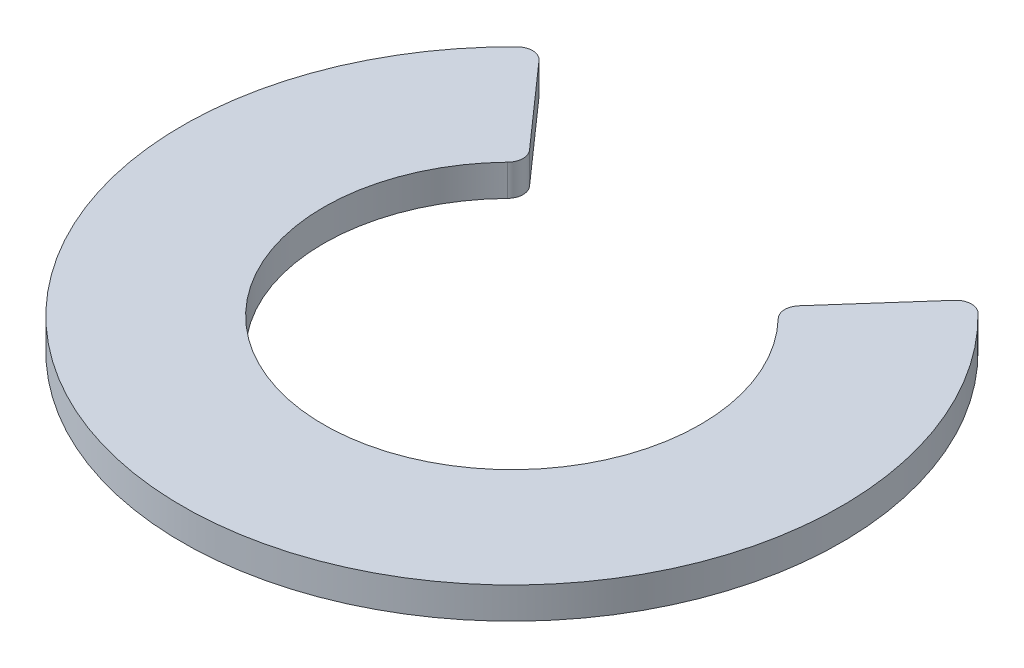
from build123d import *

# Parameters (mm, degrees)
BOSS_EXTRUDE1_DEPTH = 0.2
FILLET1_R           = 0.1


with BuildPart() as part:
    # Sketch1 → Boss-Extrude1 (new body)
    with BuildSketch(Plane(origin=(0, 0, 0), x_dir=(1, 0, 0), z_dir=(0, 1, 0))):
        with BuildLine():
            Line((-1.391459011, 1.572845135), (-0.795119435, 0.898768649))
            ThreePointArc((-0.795119435, 0.898768649), (0, -1.2), (0.795119435, 0.898768649))
            Line((0.795119435, 0.898768649), (1.391459011, 1.572845135))
            ThreePointArc((1.391459011, 1.572845135), (0, -2.1), (-1.391459011, 1.572845135))
        make_face()
    extrude(amount=BOSS_EXTRUDE1_DEPTH)

    # Fillet1
    fillet1_edges = [part.edges().sort_by_distance(p)[0] for p in [
        (-1.391459011, 0.1, -1.572845135),
        (-0.795119435, 0.1, -0.898768649),
        (0.795119435, 0.1, -0.898768649),
        (1.391459011, 0.1, -1.572845135),
    ]]
    fillet(fillet1_edges, radius=FILLET1_R)


solid = part.part
